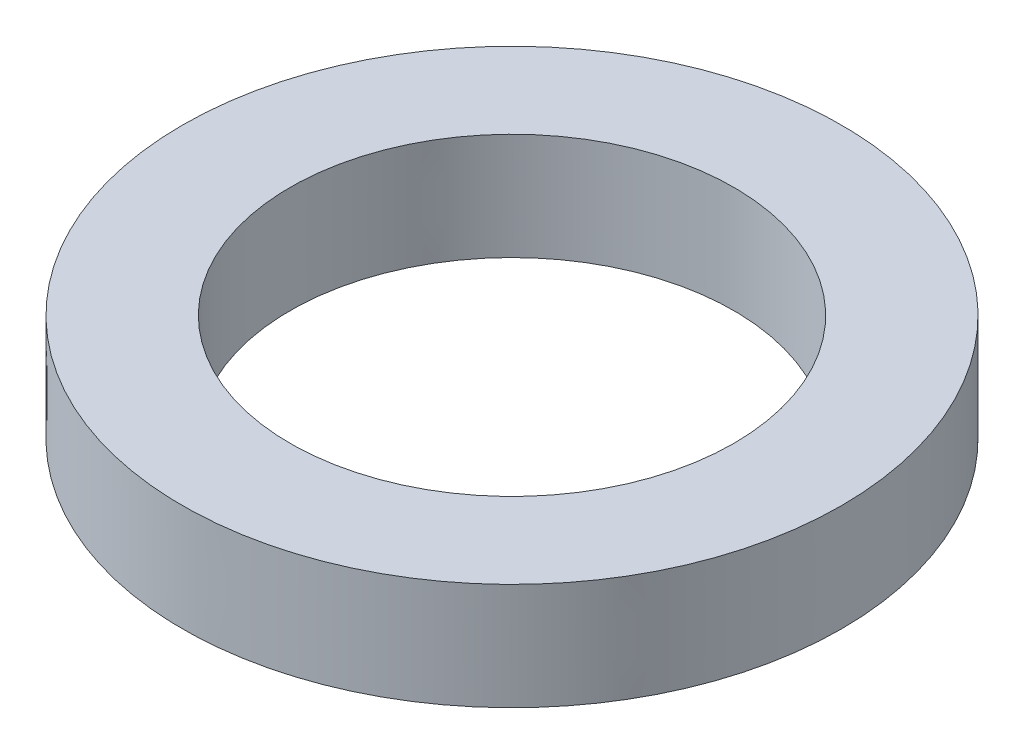
from build123d import *


with BuildPart() as part:
    # Çizim1 → Döndür1 (revolve)
    with BuildSketch(Plane.XY):
        Polygon((14.556330182, -0.000478985), (14.556330182, 4.716980057), (9.797530392, 4.716980057), (9.797530392, -0.000478985), (11.332803263, -0.000478985), (12.01520523, 2.781914958), (12.530984141, 2.810062352), (13.691331204, -0.000478985), align=None)
    revolve(axis=Axis((0, 0, 0), (4.8888323348204376e-05, 0.9999999988049659, 0)))


solid = part.part
